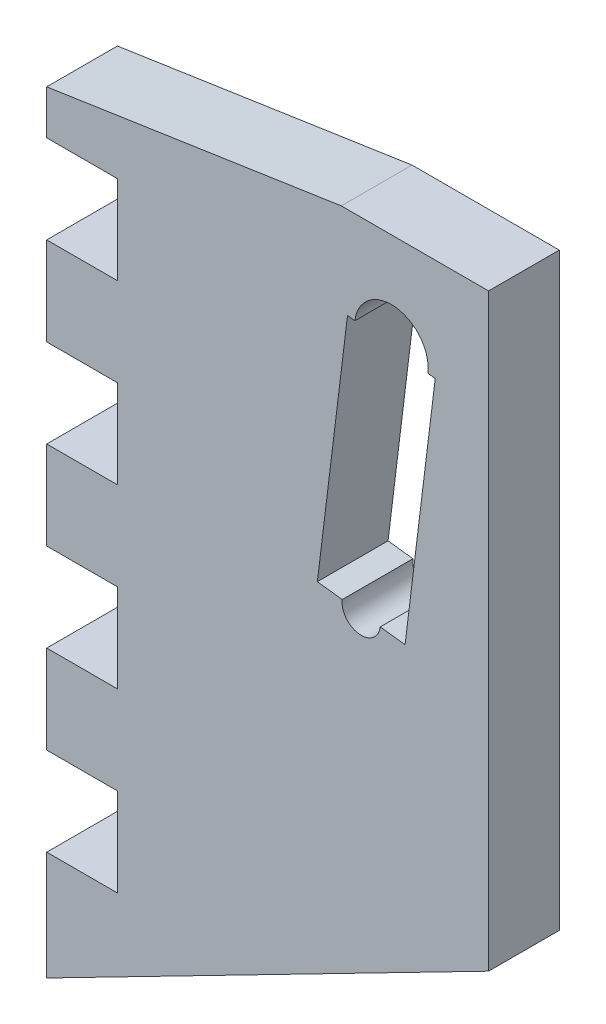
from build123d import *

# Parameters (mm, degrees)
SKETCH1_R           = 3.175
BOSS_EXTRUDE1_DEPTH = 6.096
CUT_EXTRUDE1_DEPTH  = 8.636
SKETCH4_W           = 6.096
SKETCH4_H           = 7.62
CUT_EXTRUDE2_DEPTH  = 81.243500547
SKETCH5_R           = 1.651
CUT_EXTRUDE4_DEPTH  = 6.096
CUT_EXTRUDE5_DEPTH  = 6.096


with BuildPart() as part:
    # Sketch1 → Boss-Extrude1 (new body)
    with BuildSketch(Plane.XY):
        Polygon((0, 0), (-38.1, 0), (-38.1, -7.62), (-32.004, -7.62), (-32.004, -15.24), (-38.1, -15.24), (-38.1, -22.86), (-32.004, -22.86), (-32.004, -30.48), (-38.1, -30.48), (-38.1, -38.1), (-32.004, -38.1), (-32.004, -45.72), (-38.1, -45.72), (-38.1, -70.358), (0, -50.8), align=None)
        with Locations(Location((-8.382, -8.382, 0), (0, 0, 180))):
            Circle(SKETCH1_R, mode=Mode.SUBTRACT)
    extrude(amount=BOSS_EXTRUDE1_DEPTH)

    # Sketch2 → Cut-Extrude1 (cut)
    with BuildSketch(Plane(origin=(0, 0, 0), x_dir=(-1, 0, 0), z_dir=(0, 0, -1))):
        Polygon((38.1, 0), (12.7, 0), (38.1, -3.81), align=None)
    extrude(amount=-CUT_EXTRUDE1_DEPTH, mode=Mode.SUBTRACT)

    # Sketch4 → Cut-Extrude2 (cut, through all)
    with BuildSketch(Plane.XY.offset(6.096)):
        with Locations((-35.052, -57.15)):
            Rectangle(SKETCH4_W, SKETCH4_H)
    extrude(amount=-CUT_EXTRUDE2_DEPTH, mode=Mode.SUBTRACT)

    # Sketch5 → Cut-Extrude4 (cut)
    with BuildSketch(Plane(origin=(0, 0, 0), x_dir=(-1, 0, 0), z_dir=(0, 0, -1))):
        with Locations((10.982204311, -29.558964691)):
            Circle(SKETCH5_R)
    extrude(amount=-CUT_EXTRUDE4_DEPTH, mode=Mode.SUBTRACT)

    # Sketch6 → Cut-Extrude5 (cut)
    with BuildSketch(Plane.XY.offset(6.096)):
        Polygon((-5.230665969, -8.768935165), (-4.600399162, -8.846322198), (-7.200603473, -30.02328689), (-9.343510615, -29.760170977), (-12.620898007, -29.357758405), (-14.763805149, -29.094642493), (-12.163600838, -7.917677802), (-11.533334031, -7.995064835), align=None)
    extrude(amount=-CUT_EXTRUDE5_DEPTH, mode=Mode.SUBTRACT)


solid = part.part
